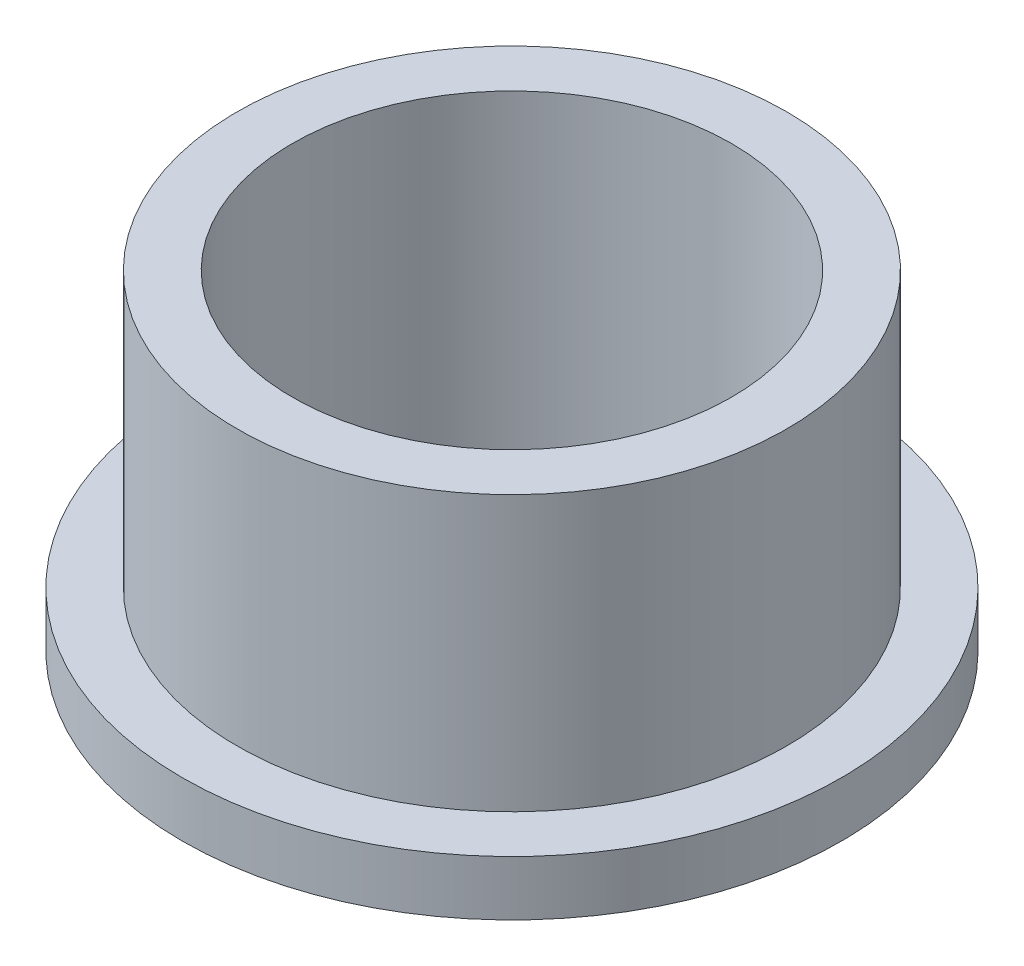
from build123d import *

# Parameters (mm, degrees)
SKETCH2_R           = 15.88135
SKETCH2_R_2         = 12.7
BOSS_EXTRUDE1_DEPTH = 19.05
SKETCH3_R           = 19.05
SKETCH3_R_2         = 15.88135
BOSS_EXTRUDE2_DEPTH = 3.175


with BuildPart() as part:
    # Sketch2 → Boss-Extrude1 (new body)
    with BuildSketch(Plane(origin=(0, 0, 0), x_dir=(1, 0, 0), z_dir=(0, 1, 0))):
        with Locations(Location((0, 0, 0), (0, 0, 90))):
            Circle(SKETCH2_R)
        with Locations(Location((0, 0, 0), (0, 0, 90))):
            Circle(SKETCH2_R_2, mode=Mode.SUBTRACT)
    extrude(amount=BOSS_EXTRUDE1_DEPTH)

    # Sketch3 → Boss-Extrude2 (add)
    with BuildSketch(Plane(origin=(0, 0, 0), x_dir=(1, 0, 0), z_dir=(0, 1, 0))):
        with Locations(Location((0, 0, 0), (0, 0, 270))):
            Circle(SKETCH3_R)
        with Locations(Location((0, 0, 0), (0, 0, 90))):
            Circle(SKETCH3_R_2, mode=Mode.SUBTRACT)
    extrude(amount=BOSS_EXTRUDE2_DEPTH)


solid = part.part
